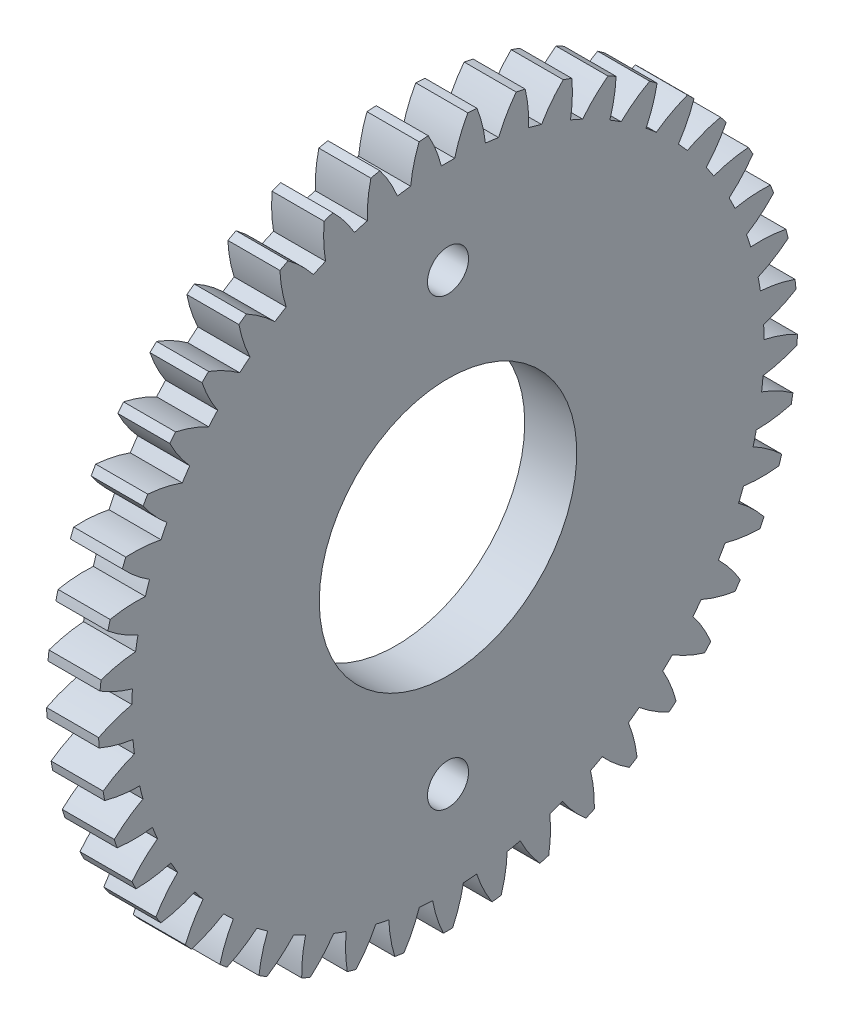
from build123d import *

# Parameters (mm, degrees)
BASPROSKE_W        = 4.445
BASPROSKE_H        = 29.845
TOOTHCUT_DEPTH     = 43.440618221
TEETHCUTS_COUNT    = 45
BORSKE_R           = 10.9982
BORE_DEPTH         = 50.8000508
SKETCH1_R          = 1.7526
CUT_EXTRUDE1_DEPTH = 43.435660866


with BuildPart() as part:
    # BasProSke → Base-Revolve (revolve)
    with BuildSketch(Plane(origin=(0, 0, 0), x_dir=(1, 0, 0), z_dir=(0, 1, 0)), mode=Mode.PRIVATE) as base_revolve_sk:
        with Locations((2.2225, 14.9225)):
            Rectangle(BASPROSKE_W, BASPROSKE_H)
    revolve(base_revolve_sk.sketch.rotate(Axis((-10, 0, 0), (1, 0, 0)), 180), axis=Axis((-10, 0, 0), (1, 0, 0)))

    # TooCutSke → ToothCut (cut, through all)
    with BuildSketch(Plane(origin=(0, 0, 0), x_dir=(0, 0, -1), z_dir=(1, 0, 0))):
        with BuildLine():
            ThreePointArc((0.569798077, 26.99418697), (0, 27.0002), (-0.569798077, 26.99418697))
            ThreePointArc((-0.569798077, 26.99418697), (-1.042025574, 28.445925733), (-1.703505172, 29.821785096))
            ThreePointArc((-1.703505172, 29.821785096), (0, 29.8704), (1.703505172, 29.821785096))
            ThreePointArc((1.703505172, 29.821785096), (1.042025574, 28.445925733), (0.569798077, 26.99418697))
        make_face()
    toothcut = extrude(amount=TOOTHCUT_DEPTH, mode=Mode.SUBTRACT)

    # TeethCuts: ToothCut ×45 about axis
    teethcuts_axis = Axis((0, 0, 0), (1, 0, 0))
    for i in range(1, TEETHCUTS_COUNT):
        add(toothcut.rotate(teethcuts_axis, i * 360 / TEETHCUTS_COUNT), mode=Mode.SUBTRACT)

    # BorSke → Bore (cut, symmetric)
    with BuildSketch(Plane(origin=(0, 0, 0), x_dir=(0, 0, -1), z_dir=(1, 0, 0))):
        with Locations(Location((0, 0, 0), (0, 0, 180))):
            Circle(BORSKE_R)
    extrude(amount=BORE_DEPTH, both=True, mode=Mode.SUBTRACT)

    # Sketch1 → Cut-Extrude1 (cut, through all)
    with BuildSketch(Plane.ZY):
        with Locations((0, 18.9992)):
            Circle(SKETCH1_R)
        with Locations((0, -18.9992)):
            Circle(SKETCH1_R)
    extrude(amount=-CUT_EXTRUDE1_DEPTH, mode=Mode.SUBTRACT)


solid = part.part
